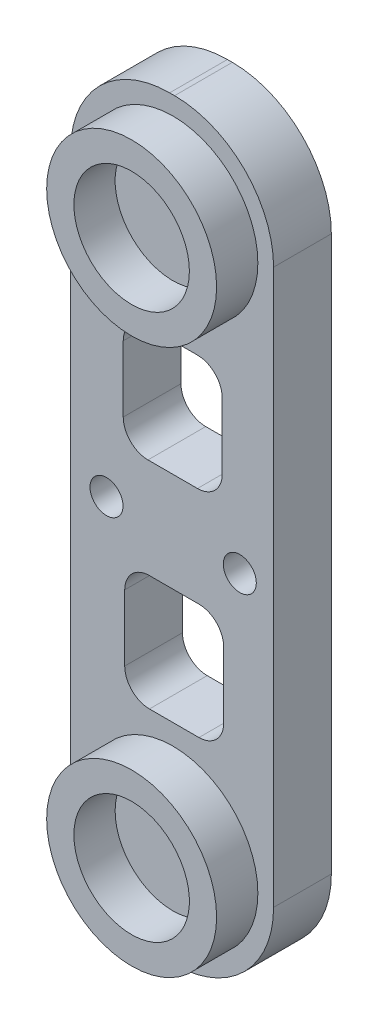
from build123d import *

# Parameters (mm, degrees)
SKETCH1_W           = 12.3
SKETCH1_H           = 45.6
SKETCH1_R           = 1
SKETCH1_W_2         = 6
SKETCH1_H_2         = 7
BOSS_EXTRUDE1_DEPTH = 3.5
FILLET1_R           = 6
FILLET2_R           = 1.5
SKETCH2_R           = 5.15
SKETCH2_R_2         = 3.5
BOSS_EXTRUDE2_DEPTH = 2.5


with BuildPart() as part:
    # Sketch1 → Boss-Extrude1 (new body)
    with BuildSketch(Plane.XY.offset(10)):
        with Locations((-295.077990014, 317.125181865)):
            Rectangle(SKETCH1_W, SKETCH1_H)
        with Locations((-290.97531395, 316.822329318)):
            Circle(SKETCH1_R, mode=Mode.SUBTRACT)
        with Locations((-299.053504652, 316.822329318)):
            Circle(SKETCH1_R, mode=Mode.SUBTRACT)
        with Locations((-294.951374343, 310.476860406)):
            Rectangle(SKETCH1_W_2, SKETCH1_H_2, mode=Mode.SUBTRACT)
        with Locations((-295.040754442, 323.502825528)):
            Rectangle(SKETCH1_W_2, SKETCH1_H_2, mode=Mode.SUBTRACT)
    extrude(amount=BOSS_EXTRUDE1_DEPTH)

    # Fillet1
    fillet1_edges = [part.edges().sort_by_distance(p)[0] for p in [
        (-301.227990014, 339.925181865, 11.75),
        (-288.927990014, 339.925181865, 11.75),
        (-288.927990014, 294.325181865, 11.75),
        (-301.227990014, 294.325181865, 11.75),
    ]]
    fillet(fillet1_edges, radius=FILLET1_R)

    # Fillet2
    fillet2_edges = [part.edges().sort_by_distance(p)[0] for p in [
        (-291.951374343, 306.976860406, 11.75),
        (-291.951374343, 313.976860406, 11.75),
        (-297.951374343, 313.976860406, 11.75),
        (-297.951374343, 306.976860406, 11.75),
        (-292.040754442, 320.002825528, 11.75),
        (-292.040754442, 327.002825528, 11.75),
        (-298.040754442, 327.002825528, 11.75),
        (-298.040754442, 320.002825528, 11.75),
    ]]
    fillet(fillet2_edges, radius=FILLET2_R)

    # Sketch2 → Boss-Extrude2 (add)
    # profile 1 of 2: a face of its own
    with BuildSketch(Plane.XY.offset(13.5)):
        with Locations((-295.031286372, 333.66110815)):
            Circle(SKETCH2_R)
        with Locations((-295.031286372, 333.66110815)):
            Circle(SKETCH2_R_2, mode=Mode.SUBTRACT)
    # profile 2 of 2: a face of its own
    with BuildSketch(Plane.XY.offset(13.5)):
        with Locations(Location((-295.031286372, 300.589255581, 0), (0, 0, 180))):
            Circle(SKETCH2_R)
        with Locations(Location((-295.031286372, 300.589255581, 0), (0, 0, 180))):
            Circle(SKETCH2_R_2, mode=Mode.SUBTRACT)
    extrude(amount=BOSS_EXTRUDE2_DEPTH)


solid = part.part
